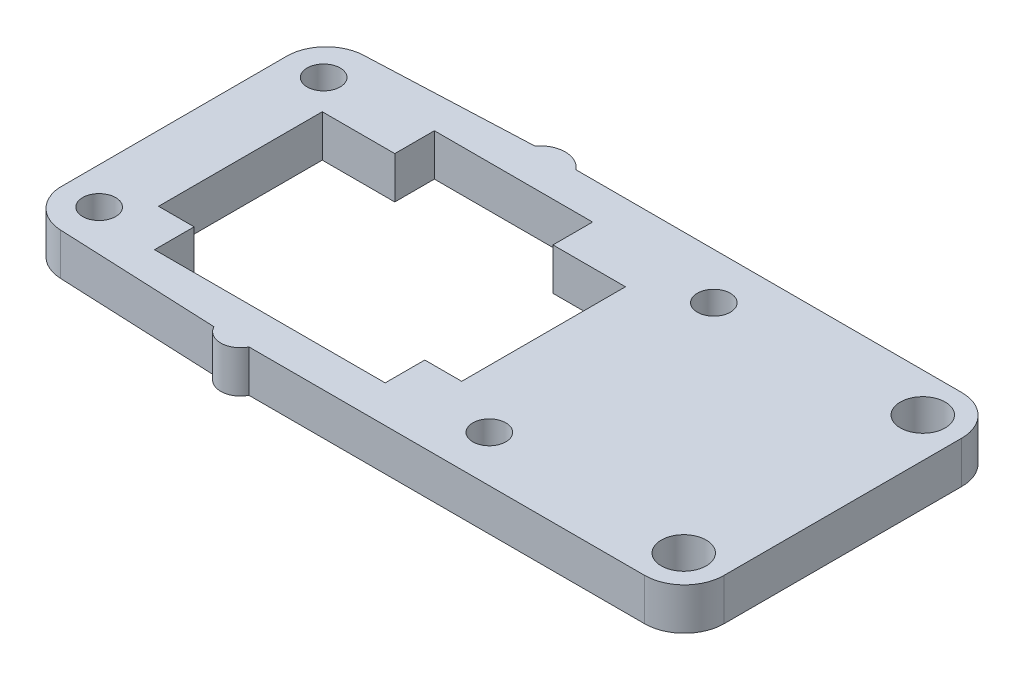
from build123d import *

# Parameters (mm, degrees)
SKETCH1_R           = 1.25
SKETCH1_R_2         = 1.7
BOSS_EXTRUDE1_DEPTH = 3.175


with BuildPart() as part:
    # Sketch1 → Boss-Extrude1 (new body)
    with BuildSketch(Plane(origin=(0, 0, 0), x_dir=(1, 0, 0), z_dir=(0, 1, 0))):
        with BuildLine():
            Line((4.709206507, -2.660218653), (34.68016435, -2.660218653))
            ThreePointArc((34.68016435, -2.660218653), (36.801406663, -1.781571318), (37.680053998, 0.339670996))
            Line((37.680053998, 0.339670996), (37.680053998, 18.345692352))
            ThreePointArc((37.680053998, 18.345692352), (36.802919812, 20.463281602), (34.685330562, 21.340415789))
            add(Edge.make_bspline(
                [(34.685330562, 21.340415789), (13.555998876, 21.34041579), (5.457536405, 21.34041579)],
                knots=[8, 8, 8, 9, 9, 9], degree=2))
            ThreePointArc((5.457536405, 21.34041579), (3.903764208, 22.107666003), (2.349992011, 21.34041579))
            Line((2.349992011, 21.34041579), (-10.092264133, 20.808084054))
            ThreePointArc((-10.092264133, 20.808084054), (-12.117989286, 19.884860301), (-12.930141677, 17.812105374))
            Line((-12.930141677, 17.812105374), (-12.916142632, 0.575581301))
            ThreePointArc((-12.916142632, 0.575581301), (-12.012905856, -1.307536184), (-10.092264134, -2.127965046))
            Line((-10.092264134, -2.127965046), (2.059487443, -2.660218653))
            ThreePointArc((2.059487443, -2.660218653), (3.384346975, -3.471607461), (4.709206507, -2.660218653))
        make_face()
        with Locations(Location((-10.13526538, 17.840261618, 0), (0, 0, 270))):
            Circle(SKETCH1_R, mode=Mode.SUBTRACT)
        with Locations(Location((-10.13526538, 0.839730428, 0), (0, 0, 270))):
            Circle(SKETCH1_R, mode=Mode.SUBTRACT)
        with Locations(Location((19.41222808, 0.839632764, 0), (0, 0, 270))):
            Circle(SKETCH1_R, mode=Mode.SUBTRACT)
        with Locations(Location((19.412228081, 17.840168837, 0), (0, 0, 270))):
            Circle(SKETCH1_R, mode=Mode.SUBTRACT)
        with Locations(Location((34.685233075, 0.289707036, 0), (0, 0, 270))):
            Circle(SKETCH1_R_2, mode=Mode.SUBTRACT)
        with Locations(Location((34.685264759, 18.390319188, 0), (0, 0, 270))):
            Circle(SKETCH1_R_2, mode=Mode.SUBTRACT)
        Polygon((12.275095957, 3.139860204), (12.225070816, 3.139860204), (12.225070816, 0.139779677), (-5.243817542, 0.139779677), (-5.243817542, 3.139860204), (-7.938965263, 3.139860204), (-7.938965263, 15.540268571), (-2.448882753, 15.540268571), (-2.448882753, 18.540349097), (9.530118068, 18.540349097), (9.530118068, 15.540268571), (15.020200579, 15.540268571), (15.020200579, 3.139860204), align=None, mode=Mode.SUBTRACT)
    extrude(amount=BOSS_EXTRUDE1_DEPTH)


solid = part.part
